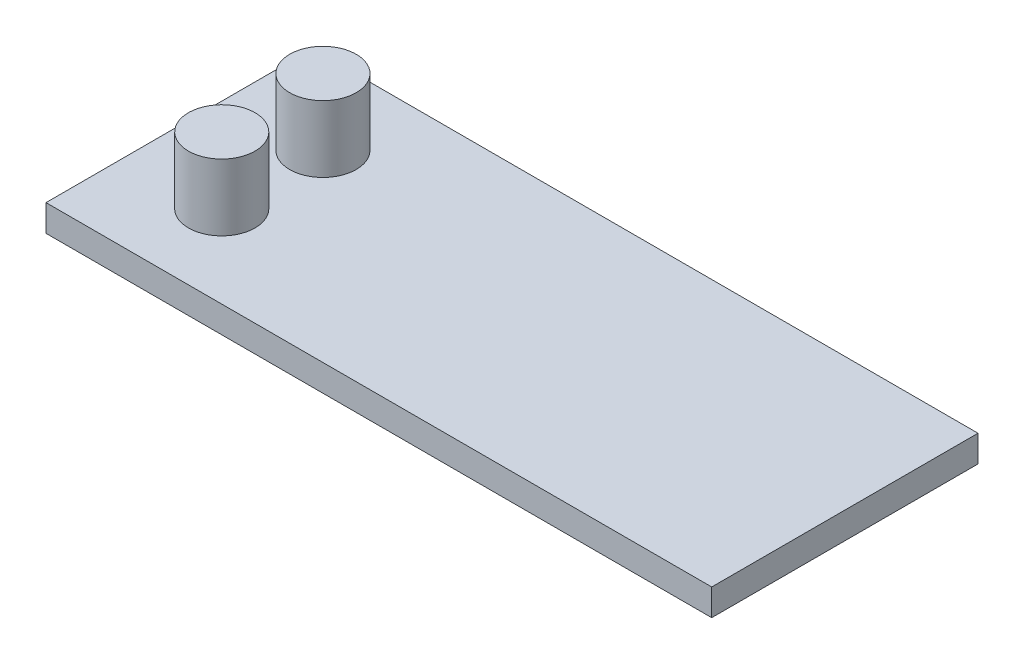
from build123d import *

# Parameters (mm, degrees)
SKETCH_1_W      = 50
SKETCH_1_H      = 20
SKETCH_1_R      = 2.5
EXTRUDE_1_DEPTH = 2
SKETCH_1_3_R    = 2.5
EXTRUDE_2_DEPTH = 7


with BuildPart() as part:
    # 草图1 → 凸台-拉伸1 (new body)
    with BuildSketch(Plane(origin=(0, 0, 0), x_dir=(1, 0, 0), z_dir=(0, 1, 0))):
        Rectangle(SKETCH_1_W, SKETCH_1_H)
        with Locations((-18, 3.8)):
            Circle(SKETCH_1_R, mode=Mode.SUBTRACT)
        with Locations((-18, -3.8)):
            Circle(SKETCH_1_R, mode=Mode.SUBTRACT)
    extrude(amount=EXTRUDE_1_DEPTH)

    # 草图1<3> → 凸台-拉伸2 (add)
    with BuildSketch(Plane(origin=(0, 0, 0), x_dir=(1, 0, 0), z_dir=(0, 1, 0))):
        with Locations((-18, 3.8)):
            Circle(SKETCH_1_3_R)
        with Locations((-18, -3.8)):
            Circle(SKETCH_1_3_R)
    extrude(amount=EXTRUDE_2_DEPTH)


solid = part.part
